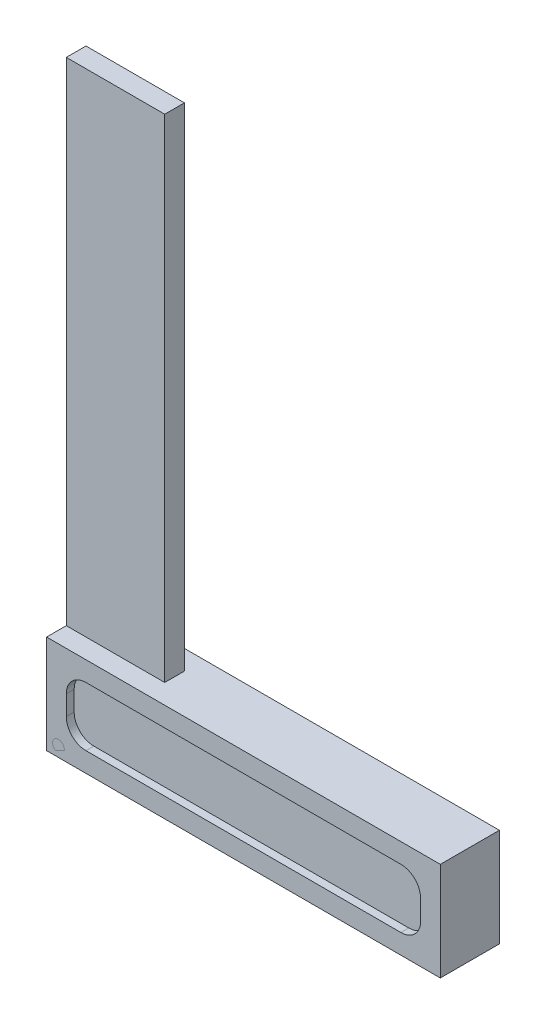
from build123d import *

# Parameters (mm, degrees)
ESQUISSE1_W             = 100
ESQUISSE1_H             = 25
BOSS_EXTRU_1_DEPTH      = 15
BOSS_EXTRU_2_DEPTH      = 25
ESQUISSE3_W             = 90
ESQUISSE3_H             = 15
ENL_V_MAT_EXTRU_1_DEPTH = 2
CONG_1_R                = 5
ESQUISSE4_R             = 1.5
BOSS_EXTRU_3_DEPTH      = 15
BOSS_EXTRU_3_2_DEPTH    = 15


with BuildPart() as part:
    # Esquisse1 → Boss.-Extru.1 (new body)
    with BuildSketch(Plane.XY):
        with Locations((50, 12.5)):
            Rectangle(ESQUISSE1_W, ESQUISSE1_H)
    extrude(amount=BOSS_EXTRU_1_DEPTH)

    # Esquisse3 → Enlèv. mat.-Extru.1 (cut)
    with BuildSketch(Plane.XY.offset(15)):
        with Locations((50, 12.5)):
            Rectangle(ESQUISSE3_W, ESQUISSE3_H)
    extrude(amount=-ENL_V_MAT_EXTRU_1_DEPTH, mode=Mode.SUBTRACT)

    # Congé1
    cong_1_edges = [part.edges().sort_by_distance(p)[0] for p in [
        (5, 5, 14),
        (5, 20, 14),
        (95, 20, 14),
        (95, 5, 14),
    ]]
    fillet(cong_1_edges, radius=CONG_1_R)


with BuildPart() as body_2:
    # Esquisse2 → Boss.-Extru.2 (new body)
    with BuildSketch(Plane.ZY):
        Polygon((5, 0), (10, 0), (10, 25), (10, 150), (5, 150), (5, 25), align=None)
    extrude(amount=-BOSS_EXTRU_2_DEPTH)


with BuildPart() as body_3:
    # Esquisse4 → Boss.-Extru.3 (new body)
    with BuildSketch(Plane.XY.offset(15)):
        with Locations((22.5, 22.5)):
            Circle(ESQUISSE4_R)
    extrude(amount=-BOSS_EXTRU_3_DEPTH)


with BuildPart() as body_4:
    # Esquisse4 → Boss.-Extru.3 2 (new body)
    with BuildSketch(Plane.XY.offset(15)):
        with Locations((3, 2.5)):
            Circle(ESQUISSE4_R)
    extrude(amount=-BOSS_EXTRU_3_2_DEPTH)


solid = Compound([part.part, body_2.part, body_3.part, body_4.part])
